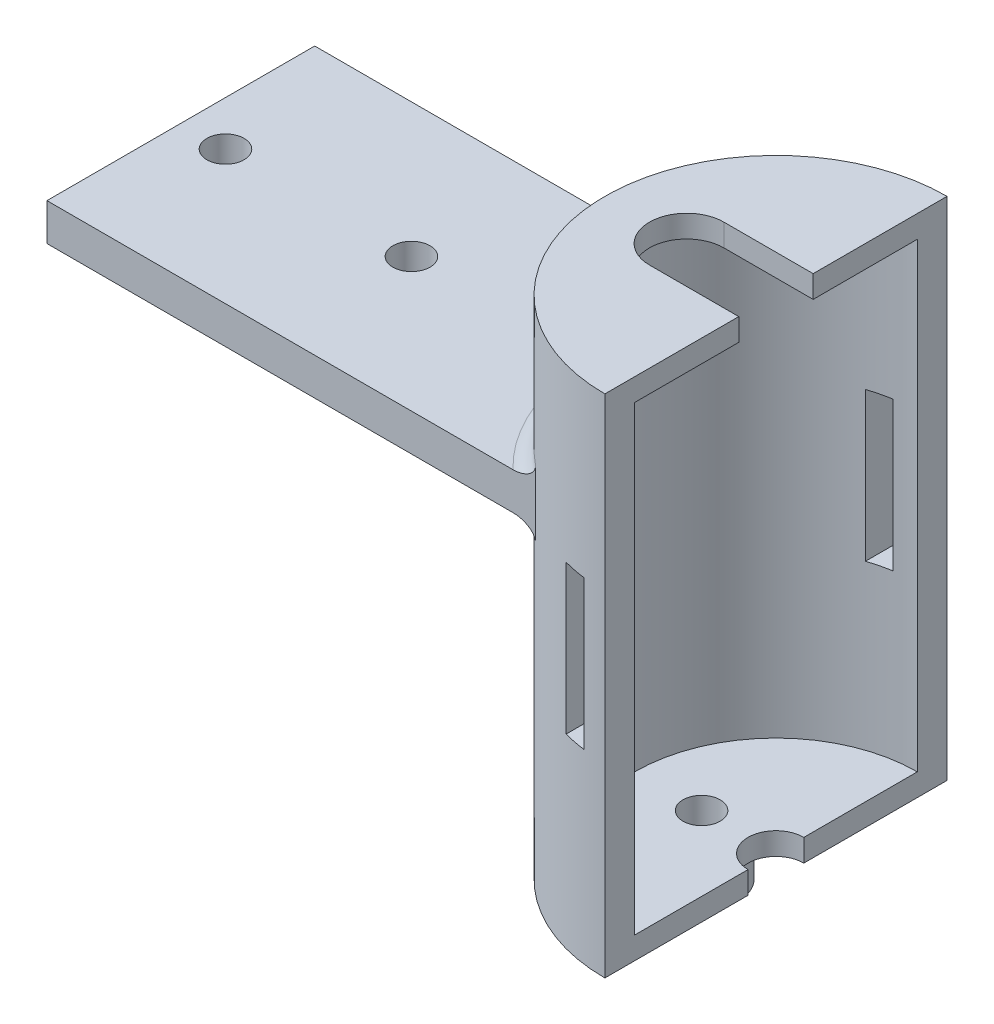
from build123d import *

# Parameters (mm, degrees)
BOSS_EXTRUDE1_DEPTH     = 62
BOSS_EXTRUDE2_START     = 3
BOSS_EXTRUDE2_DEPTH     = 3
SKETCH4_R               = 5
BOSS_EXTRUDE3_DEPTH     = 5
M6X1_0_TAPPED_HOLE1_D   = 5
CUT_EXTRUDE1_DEPTH      = 71.014284257
CUT_EXTRUDE1_DEPTH_BACK = 71.014284257
SKETCH8_W               = 3
SKETCH8_H               = 20
BOSS_EXTRUDE4_DEPTH     = 3
CUT_EXTRUDE2_REACH      = 81.919
SKETCH11_R              = 2.5
BOSS_EXTRUDE5_DEPTH     = 5
FILLET1_R               = 2


with BuildPart() as part:
    # Sketch1 → Boss-Extrude1 (new body)
    with BuildSketch(Plane(origin=(0, 0, 0), x_dir=(1, 0, 0), z_dir=(0, 1, 0))):
        with BuildLine():
            Line((0, 23), (0, 19))
            ThreePointArc((0, 19), (-19, 0), (0, -19))
            Line((0, -19), (0, -23))
            ThreePointArc((0, -23), (-23, 0), (0, 23))
        make_face()
    extrude(amount=BOSS_EXTRUDE1_DEPTH)

    # Sketch3 → Boss-Extrude2 (add)
    with BuildSketch(Plane.XZ.offset(BOSS_EXTRUDE2_START)):
        with BuildLine():
            Line((0, 23), (0, 3.75))
            ThreePointArc((0, 3.75), (-3.75, 0), (0, -3.75))
            Line((0, -3.75), (0, -23))
            ThreePointArc((0, -23), (-23, 0), (0, 23))
        make_face()
    extrude(amount=-BOSS_EXTRUDE2_DEPTH)

    # Sketch4 → Boss-Extrude3 (add)
    with BuildSketch(Plane.XZ.offset(3)):
        with Locations(Location((-10, 0, 0), (0, 0, 270))):
            Circle(SKETCH4_R)
    extrude(amount=BOSS_EXTRUDE3_DEPTH)

    # M6x1.0 Tapped Hole1 (through all)
    with Locations(Plane.XZ.offset(8)):
        with Locations((-10, 0)):
            Hole(M6X1_0_TAPPED_HOLE1_D / 2)

    # Sketch8 → Cut-Extrude1 (cut, two sides: drawn at the far end of the back side and taken through both)
    with BuildSketch(Plane.XY.offset(-CUT_EXTRUDE1_DEPTH_BACK)):
        with Locations((-4.5, 32)):
            Rectangle(SKETCH8_W, SKETCH8_H)
    extrude(amount=CUT_EXTRUDE1_DEPTH + CUT_EXTRUDE1_DEPTH_BACK, mode=Mode.SUBTRACT)

    # Sketch9 → Boss-Extrude4 (add)
    with BuildSketch(Plane(origin=(0, 62, 0), x_dir=(1, 0, 0), z_dir=(0, 1, 0))):
        with BuildLine():
            Line((0, -23), (0, 23))
            ThreePointArc((0, 23), (-23, 0), (0, -23))
        make_face()
    extrude(amount=BOSS_EXTRUDE4_DEPTH)

    # Sketch10 → Cut-Extrude2 (cut, up to next)
    with BuildSketch(Plane(origin=(0, 65, 0), x_dir=(1, 0, 0), z_dir=(0, 1, 0)), mode=Mode.PRIVATE) as cut_extrude2_sk1:
        with BuildLine():
            Line((0, -5), (-12, -5))
            ThreePointArc((-12, -5), (-17, 0), (-12, 5))
            Line((-12, 5), (0, 5))
            ThreePointArc((0, 5), (5, 0), (0, -5))
        make_face()
    cut_extrude2_tool1 = extrude(cut_extrude2_sk1.sketch, amount=-CUT_EXTRUDE2_REACH, mode=Mode.PRIVATE) & part.part
    add(cut_extrude2_tool1.solids().sort_by_distance((-6, 65, 0))[0], mode=Mode.SUBTRACT)

    # Sketch11 → Boss-Extrude5 (add)
    with BuildSketch(Plane(origin=(0, 40, 0), x_dir=(-1, 0, 0), z_dir=(0, 1, 0))):
        with BuildLine():
            Line((14.317821063, 18), (80, 18))
            Line((80, 18), (80, -18))
            Line((80, -18), (14.317821063, -18))
            ThreePointArc((14.317821063, -18), (23, 0), (14.317821063, 18))
        make_face()
        with Locations(Location((49, 0, 0), (0, 0, 90))):
            Circle(SKETCH11_R, mode=Mode.SUBTRACT)
        with Locations(Location((74, 0, 0), (0, 0, 90))):
            Circle(SKETCH11_R, mode=Mode.SUBTRACT)
    extrude(amount=BOSS_EXTRUDE5_DEPTH)

    # Fillet1
    fillet1_edges = [part.edges().sort_by_distance(p)[0] for p in [
        (-23, 40, 0),
        (-23, 45, 0),
    ]]
    fillet(fillet1_edges, radius=FILLET1_R)


solid = part.part
